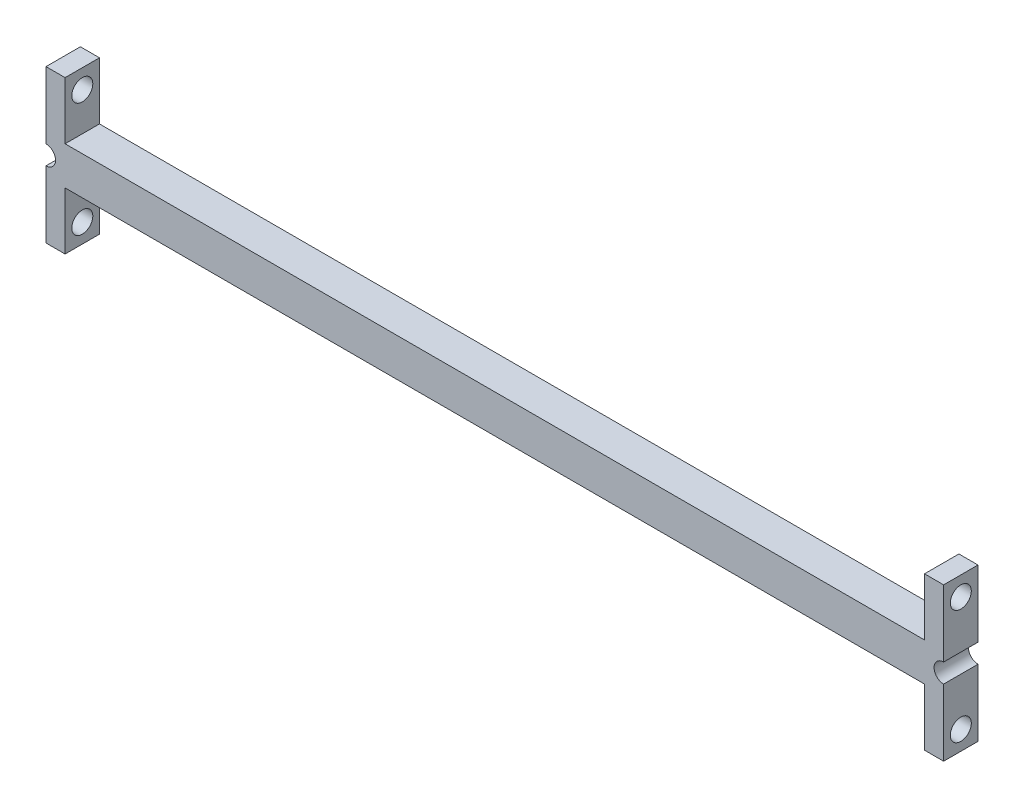
from build123d import *

# Parameters (mm, degrees)
SKETCH_1_W          = 235
SKETCH_1_H          = 10
EXTRUDE_1_DEPTH     = 9
SKETCH_2_W          = 5
SKETCH_2_H          = 40
EXTRUDE_2_DEPTH     = 9
SKETCH_3_R          = 2.5
CUT_EXTRUDE_1_DEPTH = 32
SKETCH_4_R          = 2.75
CUT_EXTRUDE_2_DEPTH = 237.497357279


with BuildPart() as part:
    # 草图1 → 凸台-拉伸1 (new body)
    with BuildSketch(Plane.XY):
        with Locations((117.5, -5)):
            Rectangle(SKETCH_1_W, SKETCH_1_H)
    extrude(amount=EXTRUDE_1_DEPTH)

    # 草图2 → 凸台-拉伸2 (add)
    with BuildSketch(Plane.XY.offset(9)):
        with Locations((232.5, -5)):
            Rectangle(SKETCH_2_W, SKETCH_2_H)
        with Locations((2.5, -5)):
            Rectangle(SKETCH_2_W, SKETCH_2_H)
    extrude(amount=-EXTRUDE_2_DEPTH)

    # 草图3 → 切除-拉伸1 (cut)
    with BuildSketch(Plane.XY.offset(9)):
        with Locations((235, -5)):
            Circle(SKETCH_3_R)
        with Locations((0, -5)):
            Circle(SKETCH_3_R)
    extrude(amount=-CUT_EXTRUDE_1_DEPTH, mode=Mode.SUBTRACT)

    # 草图4 → 切除-拉伸2 (cut, through all)
    with BuildSketch(Plane.ZY):
        with Locations(Location((4.5, 10, 0), (0, 0, 270))):
            Circle(SKETCH_4_R)
        with Locations(Location((4.5, -20, 0), (0, 0, 270))):
            Circle(SKETCH_4_R)
    extrude(amount=-CUT_EXTRUDE_2_DEPTH, mode=Mode.SUBTRACT)


solid = part.part
